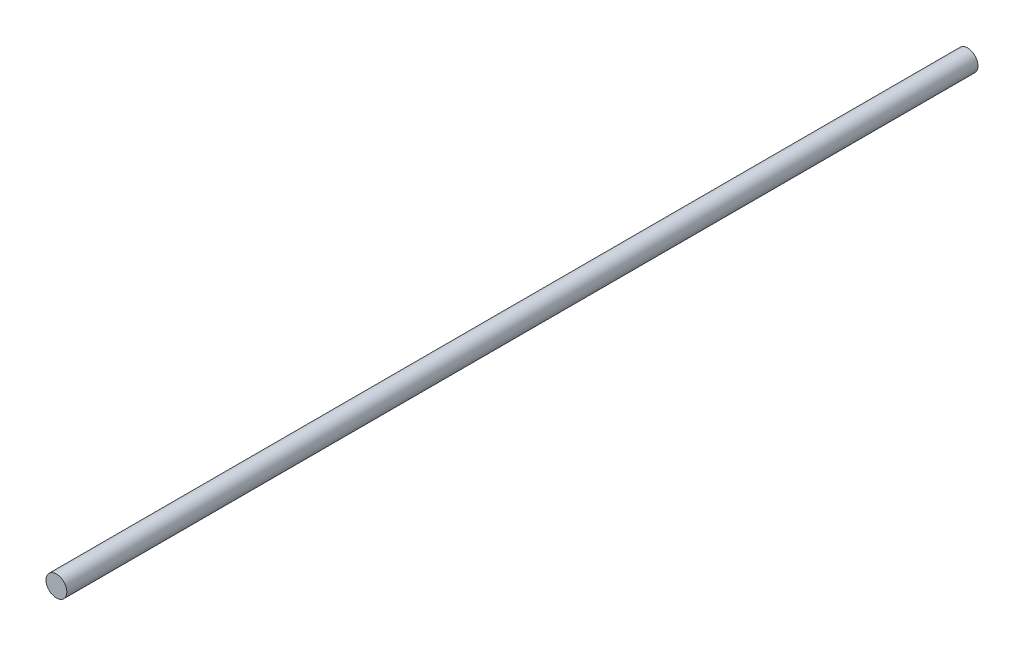
from build123d import *

# Parameters (mm, degrees)
SKETCH2_R           = 4
BOSS_EXTRUDE1_DEPTH = 350


with BuildPart() as part:
    # Sketch2 → Boss-Extrude1 (new body)
    with BuildSketch(Plane.XY):
        Circle(SKETCH2_R)
    extrude(amount=BOSS_EXTRUDE1_DEPTH)


solid = part.part
